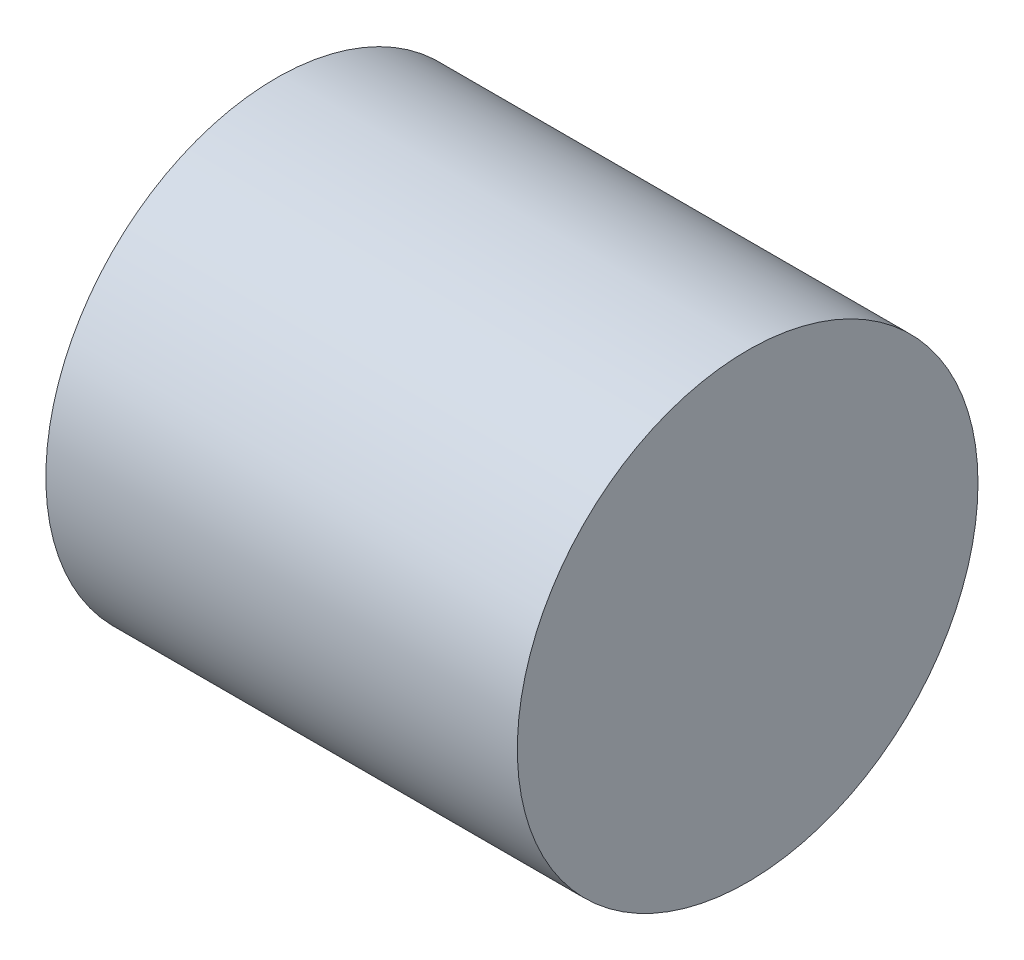
from build123d import *

# Parameters (mm, degrees)
CURVESKETCH_R   = 5.731
CURVEBOSS_DEPTH = 11.731


with BuildPart() as part:
    # CurveSketch → CurveBoss (new body)
    with BuildSketch(Plane(origin=(0, 0, 0), x_dir=(0, 0, -1), z_dir=(1, 0, 0))):
        with Locations((17.391, -9.173)):
            Circle(CURVESKETCH_R)
    extrude(amount=CURVEBOSS_DEPTH)


solid = part.part
